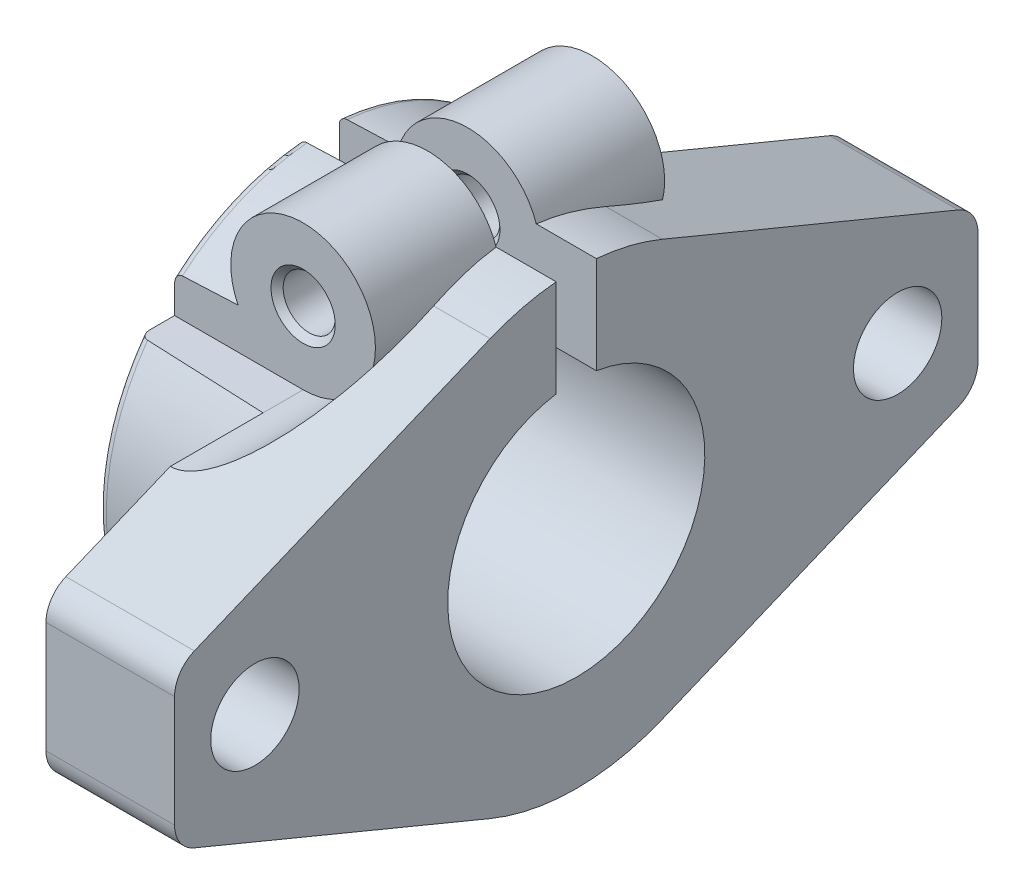
from build123d import *

# Parameters (mm, degrees)
EXTRUDE_1_DEPTH      = 8
EXTRUDE_2_DEPTH      = 9
EXTRUDE_2_DEPTH_BACK = 9
SKETCH_3_R           = 4.5
CUT_EXTRUDE_1_DEPTH  = 9
SKETCH_5_W           = 2.5
SKETCH_5_H           = 31
CUT_EXTRUDE_2_DEPTH  = 16
SKETCH_9_R           = 2.75
CUT_EXTRUDE_3_DEPTH  = 8
SKETCH_10_R          = 2.75
CUT_EXTRUDE_4_DEPTH  = 8


with BuildPart() as part:
    # 草圖1 → 填料-伸長1 (new body)
    with BuildSketch(Plane(origin=(0, 0, 0), x_dir=(0, 0, -1), z_dir=(1, 0, 0))):
        with BuildLine():
            Line((-25, 3.461794469), (-25, -3.461794469))
            ThreePointArc((-25, -3.461794469), (-24.662939225, -4.572934935), (-23.765366865, -5.309553534))
            Line((-23.765366865, -5.309553534), (-5.357568053, -12.934313455))
            ThreePointArc((-5.357568053, -12.934313455), (-2.731264508, -13.730993926), (0, -14))
            ThreePointArc((0, -14), (2.731264508, -13.730993926), (5.357568053, -12.934313455))
            Line((5.357568053, -12.934313455), (23.765366865, -5.309553534))
            ThreePointArc((23.765366865, -5.309553534), (24.662939225, -4.572934935), (25, -3.461794469))
            Line((25, -3.461794469), (25, 3.461794469))
            ThreePointArc((25, 3.461794469), (24.662939225, 4.572934935), (23.765366865, 5.309553534))
            Line((23.765366865, 5.309553534), (5.357568053, 12.934313455))
            ThreePointArc((5.357568053, 12.934313455), (2.731264508, 13.730993926), (0, 14))
            ThreePointArc((0, 14), (-2.731264508, 13.730993926), (-5.357568053, 12.934313455))
            Line((-5.357568053, 12.934313455), (-23.765366865, 5.309553534))
            ThreePointArc((-23.765366865, 5.309553534), (-24.662939225, 4.572934935), (-25, 3.461794469))
        make_face()
    extrude(amount=-EXTRUDE_1_DEPTH)

    # 草圖2 → 旋轉1 (revolve)
    with BuildSketch(Plane.XY, mode=Mode.PRIVATE) as revolve_1_sk:
        with BuildLine():
            Line((-16, 0), (-16, 13.230063946))
            ThreePointArc((-16, 13.230063946), (-15.857424619, 13.582950399), (-15.509728944, 13.737754487))
            Line((-15.509728944, 13.737754487), (-8, 14))
            Line((-8, 14), (-8, 0))
            Line((-8, 0), (-16, 0))
        make_face()
    revolve(revolve_1_sk.sketch.rotate(Axis((-8, 0, 0), (-1, 0, 0)), 270), axis=Axis((-8, 0, 0), (-1, 0, 0)))

    # 草圖3 → 填料-伸長2 (add, two sides: drawn at the far end of the back side and taken through both)
    with BuildSketch(Plane.XY.offset(-EXTRUDE_2_DEPTH_BACK)):
        with Locations((-8, 12.5)):
            Circle(SKETCH_3_R)
    extrude(amount=EXTRUDE_2_DEPTH + EXTRUDE_2_DEPTH_BACK)

    # 草圖4 → 除料-伸長1 (cut)
    with BuildSketch(Plane.XY.offset(9)):
        with BuildLine():
            Line((-16, 8), (-8, 8))
            ThreePointArc((-8, 8), (-4.818019485, 15.681980515), (-12.5, 12.5))
            Line((-12.5, 12.5), (-16, 12.5))
            Line((-16, 12.5), (-16, 8))
        make_face()
    extrude(amount=CUT_EXTRUDE_1_DEPTH, mode=Mode.SUBTRACT)

    # 草圖5 → 除料-伸長2 (cut)
    with BuildSketch(Plane(origin=(0, 0, 0), x_dir=(0, 0, -1), z_dir=(1, 0, 0))):
        with Locations((0, 15.5)):
            Rectangle(SKETCH_5_W, SKETCH_5_H)
    extrude(amount=-CUT_EXTRUDE_2_DEPTH, mode=Mode.SUBTRACT)

    # 草圖6 → 除料-旋轉1 (revolve, cut)
    with BuildSketch(Plane.XY):
        Polygon((-16, 0), (-16, 10), (-14, 10), (-14, 8), (0, 8), (0, 0), align=None)
    revolve(axis=Axis((0, 0, 0), (-1, 0, 0)), mode=Mode.SUBTRACT)

    # 草圖7 → 除料-旋轉2 (revolve, cut)
    with BuildSketch(Plane(origin=(-8, 0, 0), x_dir=(0, 0, -1), z_dir=(1, 0, 0)), mode=Mode.PRIVATE) as cut_revolve_2_sk:
        Polygon((1.25, 12.5), (1.25, 14.5), (1.629, 14.121), (8.621, 14.121), (9.1, 14.6), (13.5, 14.6), (13.5, 12.5), align=None)
    revolve(cut_revolve_2_sk.sketch.rotate(Axis((-8, 12.5, -13.5), (0, 0, 1)), 270), axis=Axis((-8, 12.5, -13.5), (0, 0, 1)), mode=Mode.SUBTRACT)

    # 草圖8 → 除料-旋轉3 (revolve, cut)
    with BuildSketch(Plane(origin=(-8, 0, 0), x_dir=(0, 0, -1), z_dir=(1, 0, 0)), mode=Mode.PRIVATE) as cut_revolve_3_sk:
        Polygon((-9, 12.5), (-9, 14.5), (-8.621, 14.121), (-1.629, 14.121), (-1.25, 14.5), (-1.25, 12.5), align=None)
    revolve(cut_revolve_3_sk.sketch.rotate(Axis((-8, 12.5, 1.25), (0, 0, 1)), 270), axis=Axis((-8, 12.5, 1.25), (0, 0, 1)), mode=Mode.SUBTRACT)

    # 草圖9 → 除料-伸長3 (cut)
    with BuildSketch(Plane(origin=(0, 0, 0), x_dir=(0, 0, -1), z_dir=(1, 0, 0))):
        with Locations((20, 0)):
            Circle(SKETCH_9_R)
    extrude(amount=-CUT_EXTRUDE_3_DEPTH, mode=Mode.SUBTRACT)

    # 草圖10 → 除料-伸長4 (cut)
    with BuildSketch(Plane(origin=(0, 0, 0), x_dir=(0, 0, -1), z_dir=(1, 0, 0))):
        with Locations((-20, 0)):
            Circle(SKETCH_10_R)
    extrude(amount=-CUT_EXTRUDE_4_DEPTH, mode=Mode.SUBTRACT)


solid = part.part
